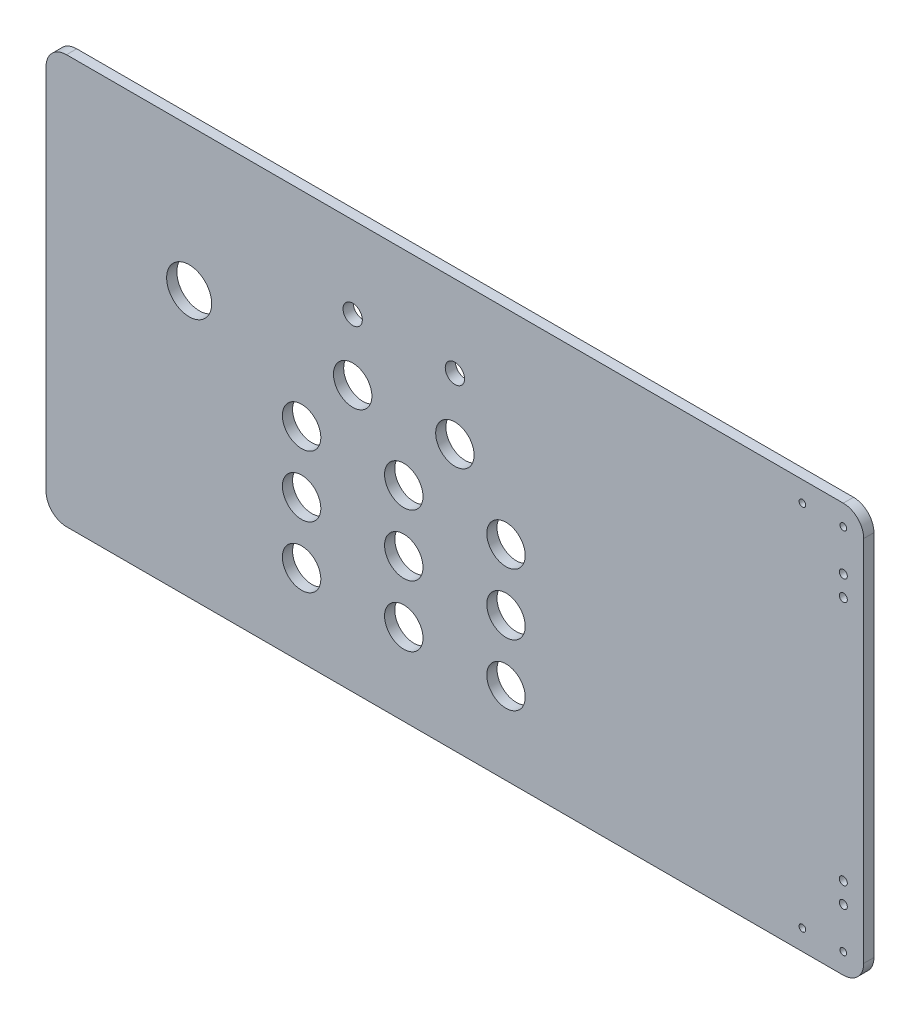
from build123d import *

# Parameters (mm, degrees)
SKETCH1_W           = 508
SKETCH1_H           = 254
BOSS_EXTRUDE1_DEPTH = 6.35
SKETCH3_R           = 11.938
SKETCH3_R_2         = 6
SKETCH3_R_3         = 14
CUT_EXTRUDE2_DEPTH  = 568.996762755
FILLET1_R           = 12.7
SKETCH4_R           = 2.0701
SKETCH4_R_2         = 2.4892
CUT_EXTRUDE3_DEPTH  = 568.996762755


with BuildPart() as part:
    # Sketch1 → Boss-Extrude1 (new body)
    with BuildSketch(Plane.XY):
        with Locations((254, 127)):
            Rectangle(SKETCH1_W, SKETCH1_H)
    extrude(amount=BOSS_EXTRUDE1_DEPTH)

    # Sketch3 → Cut-Extrude2 (cut, through all)
    with BuildSketch(Plane(origin=(0, 0, 0), x_dir=(-1, 0, 0), z_dir=(0, 0, -1))):
        with Locations((-158.75, 88.9)):
            Circle(SKETCH3_R)
        with Locations((-222.25, 88.9)):
            Circle(SKETCH3_R)
        with Locations((-158.75, 50.8)):
            Circle(SKETCH3_R)
        with Locations((-222.25, 50.8)):
            Circle(SKETCH3_R)
        with Locations((-222.25, 127)):
            Circle(SKETCH3_R)
        with Locations((-285.75, 127)):
            Circle(SKETCH3_R)
        with Locations((-285.75, 88.9)):
            Circle(SKETCH3_R)
        with Locations((-285.75, 50.8)):
            Circle(SKETCH3_R)
        with Locations((-254, 203.2)):
            Circle(SKETCH3_R_2)
        with Locations((-190.5, 203.2)):
            Circle(SKETCH3_R_2)
        with Locations((-158.75, 127)):
            Circle(SKETCH3_R)
        with Locations((-190.5, 165.1)):
            Circle(SKETCH3_R)
        with Locations((-254, 165.1)):
            Circle(SKETCH3_R)
        with Locations((-88.9, 165.1)):
            Circle(SKETCH3_R_3)
    extrude(amount=-CUT_EXTRUDE2_DEPTH, mode=Mode.SUBTRACT)

    # Fillet1
    fillet1_edges = [part.edges().sort_by_distance(p)[0] for p in [
        (508, 0, 3.175),
        (0, 0, 3.175),
        (0, 254, 3.175),
        (508, 254, 3.175),
    ]]
    fillet(fillet1_edges, radius=FILLET1_R)

    # Sketch4 → Cut-Extrude3 (cut, through all)
    with BuildSketch(Plane(origin=(0, 0, 0), x_dir=(-1, 0, 0), z_dir=(0, 0, -1))):
        with Locations((-495.320545376, 241.3)):
            Circle(SKETCH4_R)
        with Locations((-469.920545376, 241.3)):
            Circle(SKETCH4_R)
        with Locations((-495.320545376, 215.9)):
            Circle(SKETCH4_R_2)
        with Locations((-495.320545376, 203.2)):
            Circle(SKETCH4_R_2)
        with Locations((-469.920545376, 12.7)):
            Circle(SKETCH4_R)
        with Locations((-495.320545376, 50.8)):
            Circle(SKETCH4_R_2)
        with Locations((-495.320545376, 38.1)):
            Circle(SKETCH4_R_2)
        with Locations((-495.320545376, 12.7)):
            Circle(SKETCH4_R)
    extrude(amount=-CUT_EXTRUDE3_DEPTH, mode=Mode.SUBTRACT)


solid = part.part
